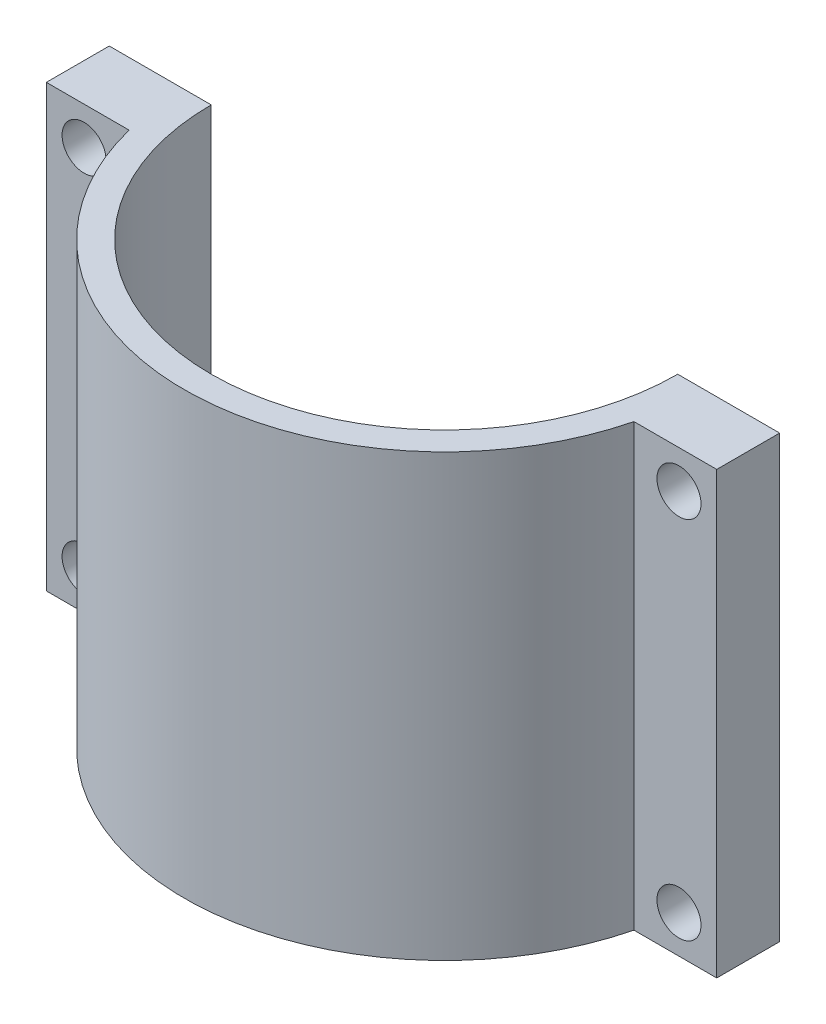
from build123d import *

# Parameters (mm, degrees)
SKETCH1_R             = 1.75
BOSS_EXTRUDE1_DEPTH   = 5
BOSS_EXTRUDE1_2_DEPTH = 5
SKETCH1_2_R           = 1.75
BOSS_EXTRUDE2_DEPTH   = 5
BOSS_EXTRUDE3_DEPTH   = 35


with BuildPart() as part:
    # Sketch1 → Boss-Extrude1 (new body)
    with BuildSketch(Plane.XY):
        Polygon((-3, 3), (5.1, 3), (5.1, -32), (-3, -32), (-3, -26), align=None)
        Circle(SKETCH1_R, mode=Mode.SUBTRACT)
        with Locations(Location((0, -29, 0), (0, 0, 180))):
            Circle(SKETCH1_R, mode=Mode.SUBTRACT)
    extrude(amount=BOSS_EXTRUDE1_DEPTH)



with BuildPart() as body_2:
    # Sketch1 → Boss-Extrude1 2 (new body)
    with BuildSketch(Plane.XY):
        Polygon((50.27, 3), (42.17, 3), (42.17, -32), (50.27, -32), (50.27, -26), align=None)
        with Locations((47.27, 0)):
            Circle(SKETCH1_R, mode=Mode.SUBTRACT)
        with Locations(Location((47.27, -29, 0), (0, 0, 180))):
            Circle(SKETCH1_R, mode=Mode.SUBTRACT)
    extrude(amount=BOSS_EXTRUDE1_2_DEPTH)


with BuildPart() as part_1:
    add(part.part)

    add(body_2.part)  # Boss-Extrude2 merges body 2
    # Sketch1<2> → Boss-Extrude2 (add)
    # profile 1 of 2: a face of its own
    with BuildSketch(Plane.XY):
        Polygon((-3, 3), (5.1, 3), (5.1, -32), (-3, -32), (-3, -26), align=None)
        Circle(SKETCH1_2_R, mode=Mode.SUBTRACT)
        with Locations(Location((0, -29, 0), (0, 0, 180))):
            Circle(SKETCH1_2_R, mode=Mode.SUBTRACT)
    # profile 2 of 2: a face of its own
    with BuildSketch(Plane.XY):
        Polygon((50.27, 3), (42.17, 3), (42.17, -32), (50.27, -32), (50.27, -26), align=None)
        with Locations((47.27, 0)):
            Circle(SKETCH1_2_R, mode=Mode.SUBTRACT)
        with Locations(Location((47.27, -29, 0), (0, 0, 180))):
            Circle(SKETCH1_2_R, mode=Mode.SUBTRACT)
    extrude(amount=BOSS_EXTRUDE2_DEPTH)

    # Sketch2 → Boss-Extrude3 (add)
    with BuildSketch(Plane(origin=(0, 3, 0), x_dir=(1, 0, 0), z_dir=(0, 1, 0))):
        with BuildLine():
            Line((42.17, 0), (44.305, 0))
            ThreePointArc((44.305, 0), (23.635, -20.67), (2.965, 0))
            Line((2.965, 0), (5.1, 0))
            ThreePointArc((5.1, 0), (23.635, -18.535), (42.17, 0))
        make_face()
    extrude(amount=-BOSS_EXTRUDE3_DEPTH)


solid = part_1.part
